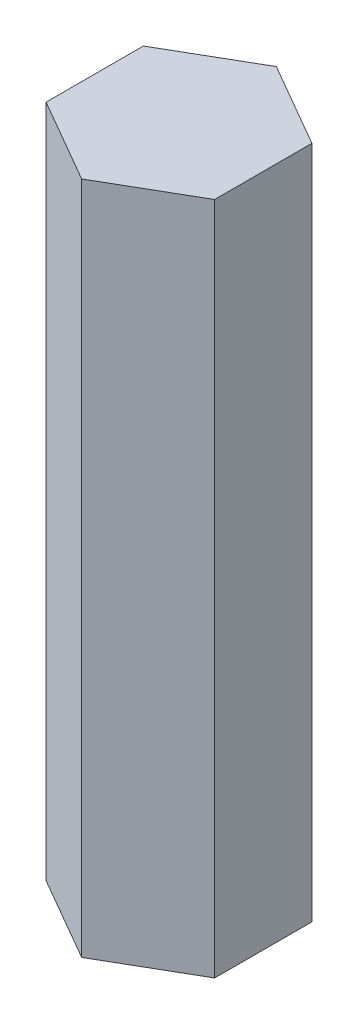
from build123d import *

# Parameters (mm, degrees)
BOSS_EXTRUDE1_DEPTH = 20


with BuildPart() as part:
    # Sketch1 → Boss-Extrude1 (new body)
    with BuildSketch(Plane(origin=(0, 0, 0), x_dir=(1, 0, 0), z_dir=(0, 1, 0))):
        Polygon((2.5, -1.443375673), (2.5, 1.443375673), (0, 2.886751346), (-2.5, 1.443375673), (-2.5, -1.443375673), (0, -2.886751346), align=None)
    extrude(amount=BOSS_EXTRUDE1_DEPTH)


solid = part.part
